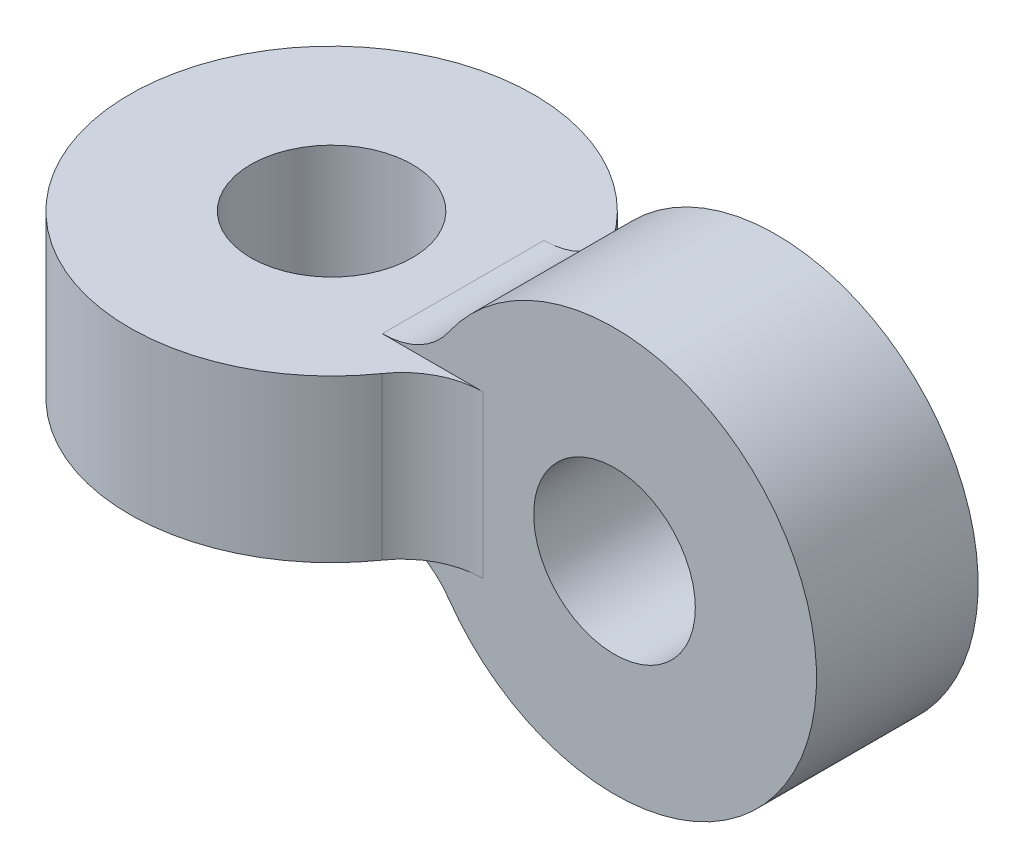
from build123d import *

# Parameters (mm, degrees)
SKETCH1_R           = 2.5
SKETCH1_R_2         = 1
BOSS_EXTRUDE2_DEPTH = 2
SKETCH2_R           = 2.5
SKETCH2_R_2         = 1
BOSS_EXTRUDE3_DEPTH = 1
FILLET3_R           = 1
FILLET4_R           = 1
FILLET5_R           = 1
FILLET8_R           = 1


with BuildPart() as part:
    # Sketch1 → Boss-Extrude2 (new body)
    with BuildSketch(Plane(origin=(0, 0, 0), x_dir=(1, 0, 0), z_dir=(0, 1, 0))):
        with Locations(Location((0, 0, 0), (0, 0, 270))):
            Circle(SKETCH1_R)
        with Locations(Location((0, 0, 0), (0, 0, 270))):
            Circle(SKETCH1_R_2, mode=Mode.SUBTRACT)
    extrude(amount=BOSS_EXTRUDE2_DEPTH)

    # Sketch2 → Boss-Extrude3 (add, symmetric)
    with BuildSketch(Plane.XY):
        with Locations((4.5, 1)):
            Circle(SKETCH2_R)
        with Locations((4.5, 1)):
            Circle(SKETCH2_R_2, mode=Mode.SUBTRACT)
    extrude(amount=BOSS_EXTRUDE3_DEPTH, both=True)

    # Fillet3
    fillet3_edges = [part.edges().sort_by_distance(p)[0] for p in [
        (2.208712153, 2, 0),
    ]]
    fillet(fillet3_edges, radius=FILLET3_R)

    # Fillet4
    fillet4_edges = [part.edges().sort_by_distance(p)[0] for p in [
        (2.208712153, 0, 0),
    ]]
    fillet(fillet4_edges, radius=FILLET4_R)

    # Fillet5
    fillet5_edges = [part.edges().sort_by_distance(p)[0] for p in [
        (2.291287847, 1, -1),
    ]]
    fillet(fillet5_edges, radius=FILLET5_R)

    # Fillet8
    fillet8_edges = [part.edges().sort_by_distance(p)[0] for p in [
        (2.291287847, 1, 1),
    ]]
    fillet(fillet8_edges, radius=FILLET8_R)


solid = part.part
